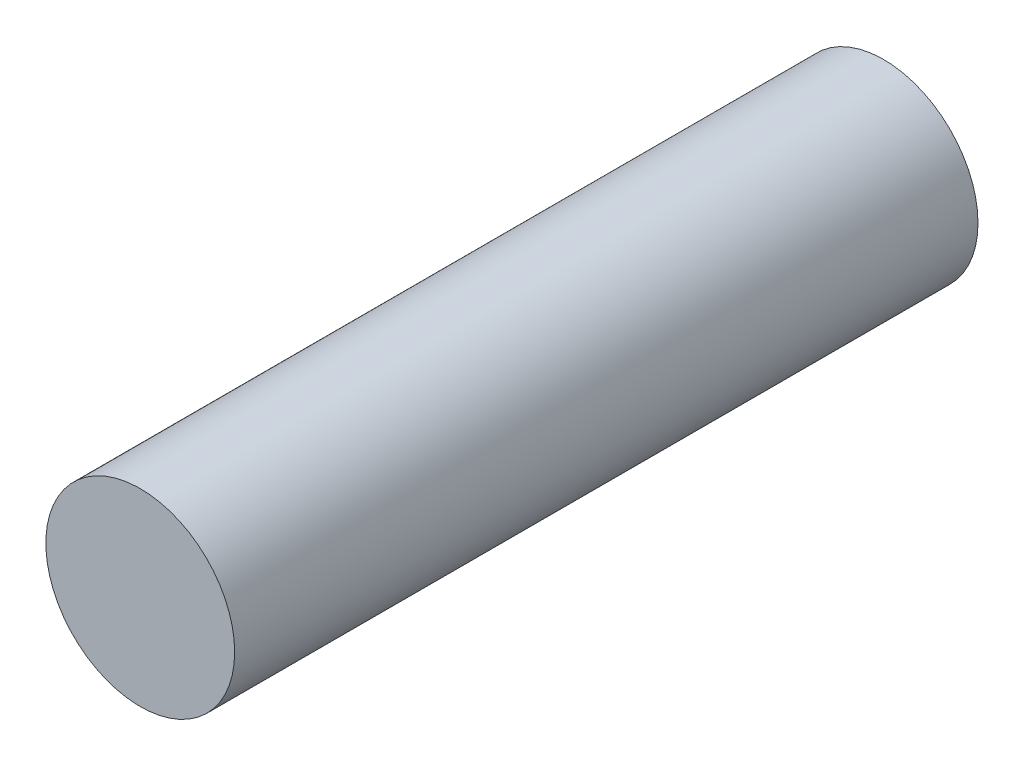
from build123d import *

# Parameters (mm, degrees)
CROQUIS1_R              = 6.35
SALIENTE_EXTRUIR1_DEPTH = 50


with BuildPart() as part:
    # Croquis1 → Saliente-Extruir1 (new body)
    with BuildSketch(Plane.XY):
        Circle(CROQUIS1_R)
    extrude(amount=SALIENTE_EXTRUIR1_DEPTH)


solid = part.part
